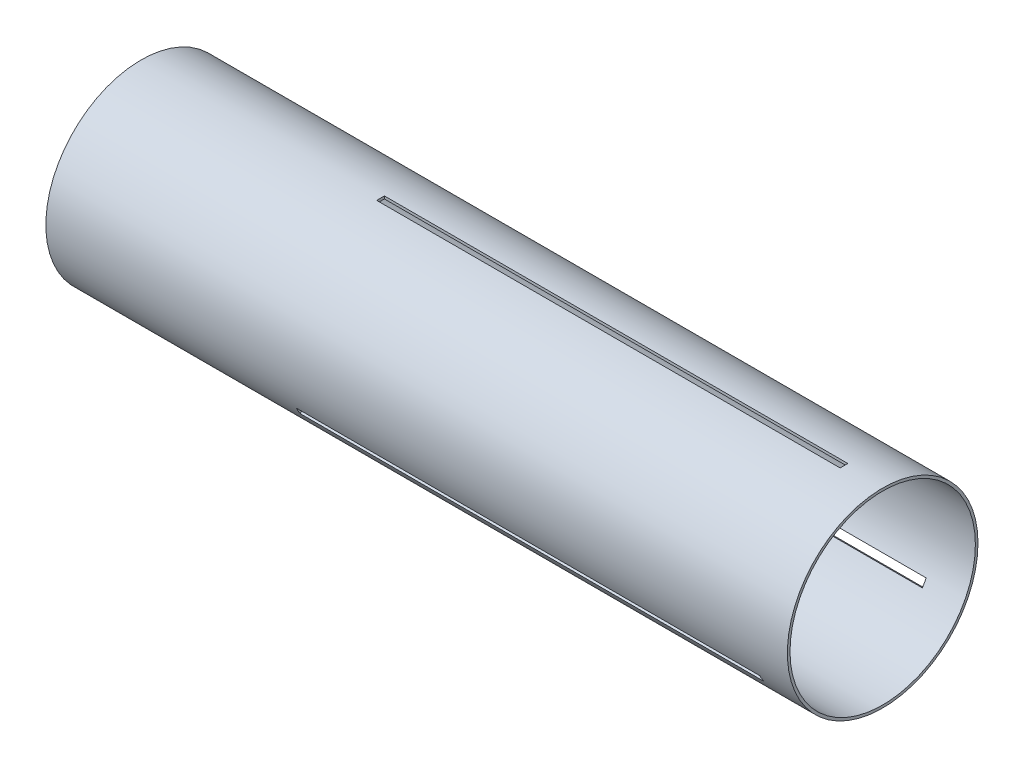
from build123d import *

# Parameters (mm, degrees)
SKETCH1_R           = 78.359
SKETCH1_R_2         = 76.2
BOSS_EXTRUDE1_DEPTH = 609.6
CUT_EXTRUDE1_START  = -381
CUT_EXTRUDE1_DEPTH  = 381
CIRPATTERN1_COUNT   = 3


with BuildPart() as part:
    # Sketch1 → Boss-Extrude1 (new body)
    with BuildSketch(Plane(origin=(0, 0, 0), x_dir=(0, 0, -1), z_dir=(1, 0, 0))):
        with Locations(Location((0, 0, 0), (0, 0, 180))):
            Circle(SKETCH1_R)
        with Locations(Location((0, 0, 0), (0, 0, 180))):
            Circle(SKETCH1_R_2, mode=Mode.SUBTRACT)
    extrude(amount=BOSS_EXTRUDE1_DEPTH)

    # Sketch3 → Cut-Extrude1 (cut)
    with BuildSketch(Plane(origin=(577.85, 0, 0), x_dir=(0, 0, -1), z_dir=(1, 0, 0)).offset(CUT_EXTRUDE1_START)):
        with BuildLine():
            Line((-3.175, 78.294650239), (-3.175, 76.133825433))
            ThreePointArc((-3.175, 76.133825433), (0, 76.2), (3.175, 76.133825433))
            Line((3.175, 76.133825433), (3.175, 78.294650239))
            ThreePointArc((3.175, 78.294650239), (0, 78.359), (-3.175, 78.294650239))
        make_face()
    cut_extrude1 = extrude(amount=CUT_EXTRUDE1_DEPTH, mode=Mode.SUBTRACT)

    # CirPattern1: Cut-Extrude1 ×3 about axis
    cirpattern1_axis = Axis((0, 0, 0), (1, 0, 0))
    for i in range(1, CIRPATTERN1_COUNT):
        add(cut_extrude1.rotate(cirpattern1_axis, i * 360 / CIRPATTERN1_COUNT), mode=Mode.SUBTRACT)


solid = part.part
